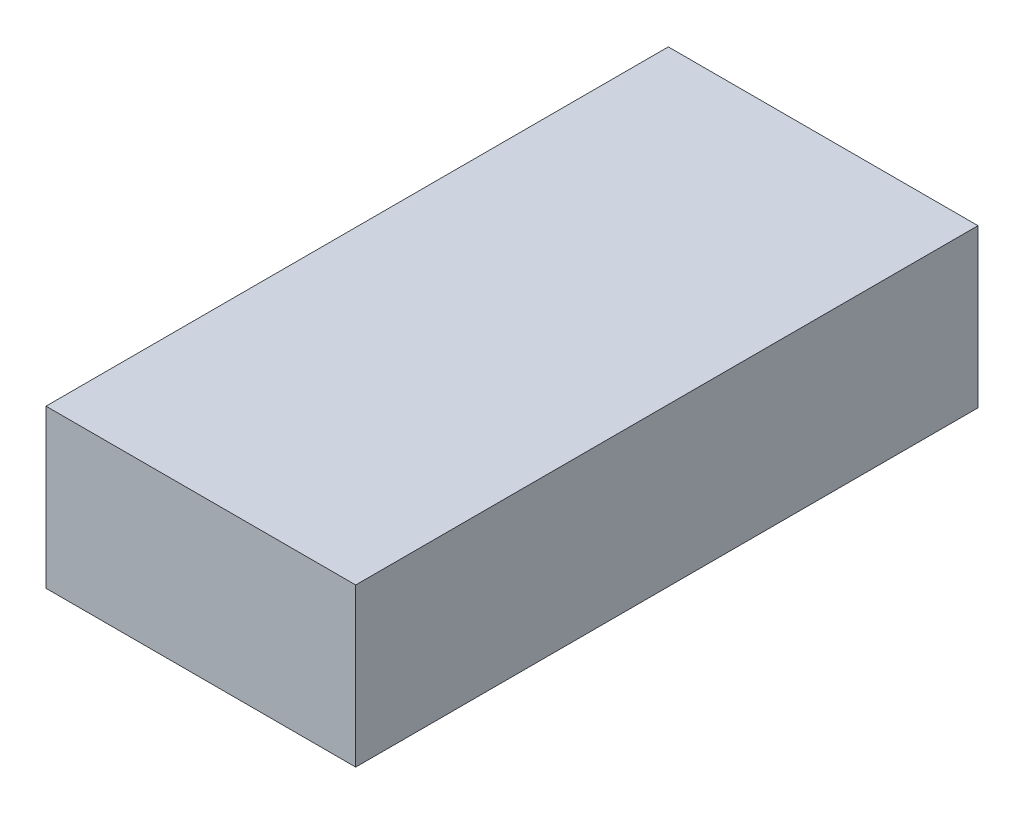
from build123d import *

# Parameters (mm, degrees)
SKETCH1_W           = 106
SKETCH1_H           = 213
BOSS_EXTRUDE1_DEPTH = 54


with BuildPart() as part:
    # Sketch1 → Boss-Extrude1 (new body)
    with BuildSketch(Plane(origin=(0, 0, 0), x_dir=(1, 0, 0), z_dir=(0, 1, 0))):
        Rectangle(SKETCH1_W, SKETCH1_H)
    extrude(amount=BOSS_EXTRUDE1_DEPTH)


solid = part.part
